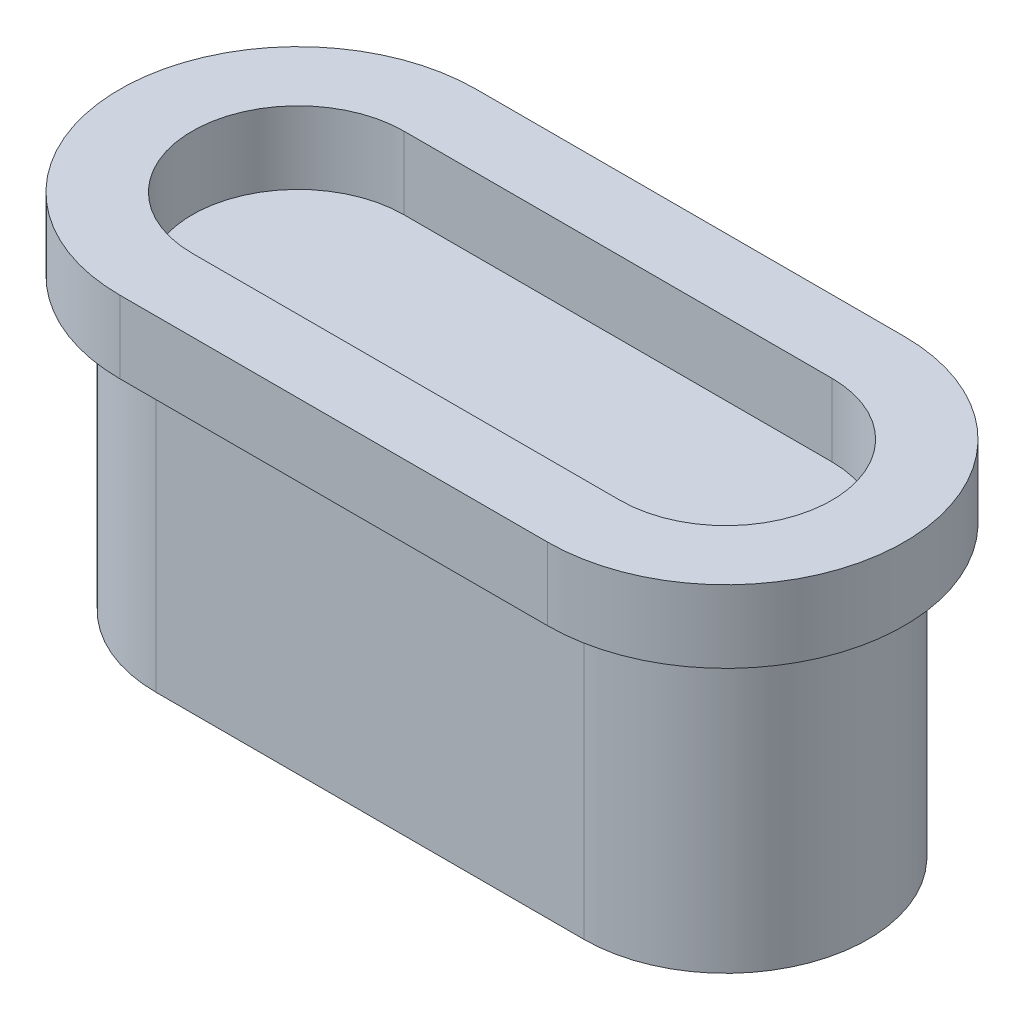
from build123d import *

# Parameters (mm, degrees)
EXTRUDE_1_DEPTH      = 20
EXTRUDE_1_DEPTH_BACK = 20
EXTRUDE_1_2_DEPTH    = 10


with BuildPart() as part:
    # 草图1 → Extrude 1 (new, two sides: drawn at the far end of the back side and taken through both)
    with BuildSketch(Plane(origin=(0, 0, 0), x_dir=(1, 0, 0), z_dir=(0, 1, 0)).offset(-EXTRUDE_1_DEPTH_BACK)):
        with BuildLine():
            Line((0, 19.612627737), (59.092592661, 19.612627737))
            ThreePointArc((59.092592661, 19.612627737), (78.705220398, 0), (59.092592661, -19.612627737))
            Line((59.092592661, -19.612627737), (0, -19.612627737))
            ThreePointArc((0, -19.612627737), (-19.612627737, 0), (0, 19.612627737))
        make_face()
    extrude(amount=EXTRUDE_1_DEPTH + EXTRUDE_1_DEPTH_BACK)

    # 草图4 → Extrude 1 2 (add)
    with BuildSketch(Plane(origin=(0, 20, 0), x_dir=(1, 0, 0), z_dir=(0, 1, 0))):
        with BuildLine():
            Line((59.092592661, 24.612627737), (0, 24.612627737))
            ThreePointArc((0, 24.612627737), (-24.612627737, 0), (0, -24.612627737))
            Line((0, -24.612627737), (59.092592661, -24.612627737))
            ThreePointArc((59.092592661, -24.612627737), (83.705220398, 0), (59.092592661, 24.612627737))
        make_face()
        with BuildLine():
            Line((59.092592661, 14.612627737), (0, 14.612627737))
            ThreePointArc((0, 14.612627737), (-14.612627737, 0), (0, -14.612627737))
            Line((0, -14.612627737), (59.092592661, -14.612627737))
            ThreePointArc((59.092592661, -14.612627737), (73.705220398, 0), (59.092592661, 14.612627737))
        make_face(mode=Mode.SUBTRACT)
    extrude(amount=EXTRUDE_1_2_DEPTH)


solid = part.part
